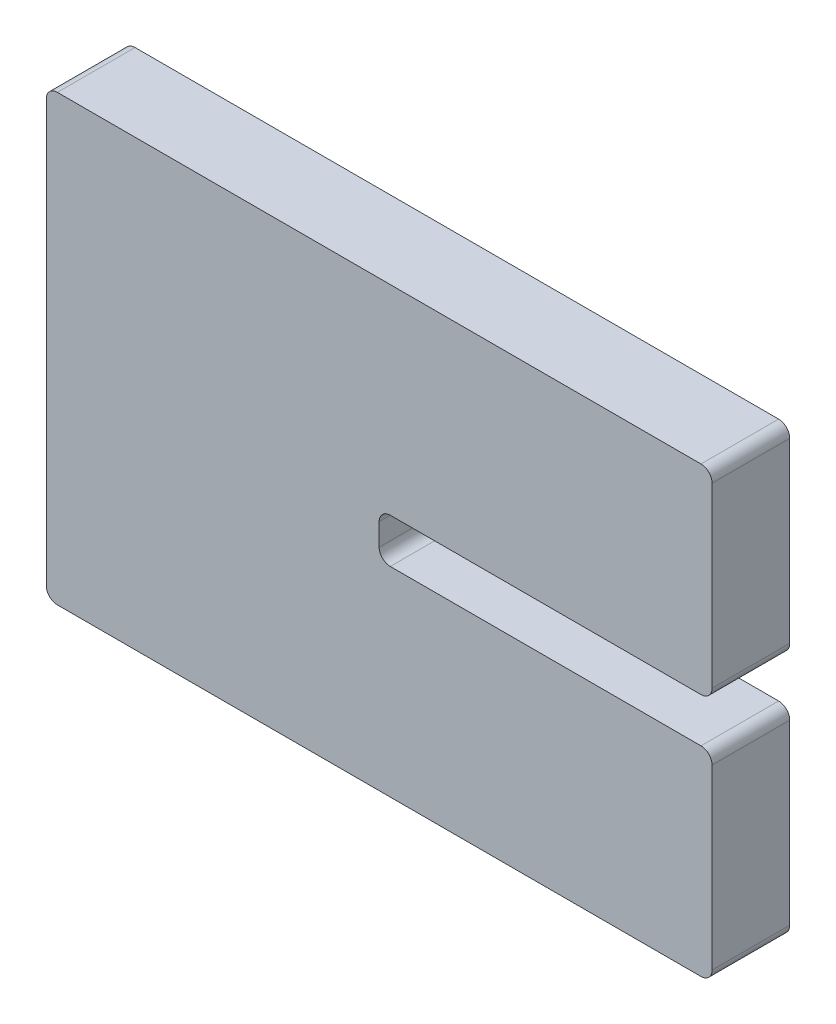
from build123d import *

# Parameters (mm, degrees)
BOSS_EXTRUDE1_DEPTH = 3.5
FILLET1_R           = 0.5


with BuildPart() as part:
    # Sketch1 → Boss-Extrude1 (new body)
    with BuildSketch(Plane.XY):
        Polygon((15, -1), (15, -10), (-15, -10), (-15, 10), (15, 10), (15, 1), (0, 1), (0, -1), align=None)
    extrude(amount=BOSS_EXTRUDE1_DEPTH)

    # Fillet1
    fillet1_edges = [part.edges().sort_by_distance(p)[0] for p in [
        (-15, -10, 1.75),
        (-15, 10, 1.75),
        (15, 10, 1.75),
        (15, 1, 1.75),
        (0, 1, 1.75),
        (0, -1, 1.75),
        (15, -1, 1.75),
        (15, -10, 1.75),
    ]]
    fillet(fillet1_edges, radius=FILLET1_R)


solid = part.part
